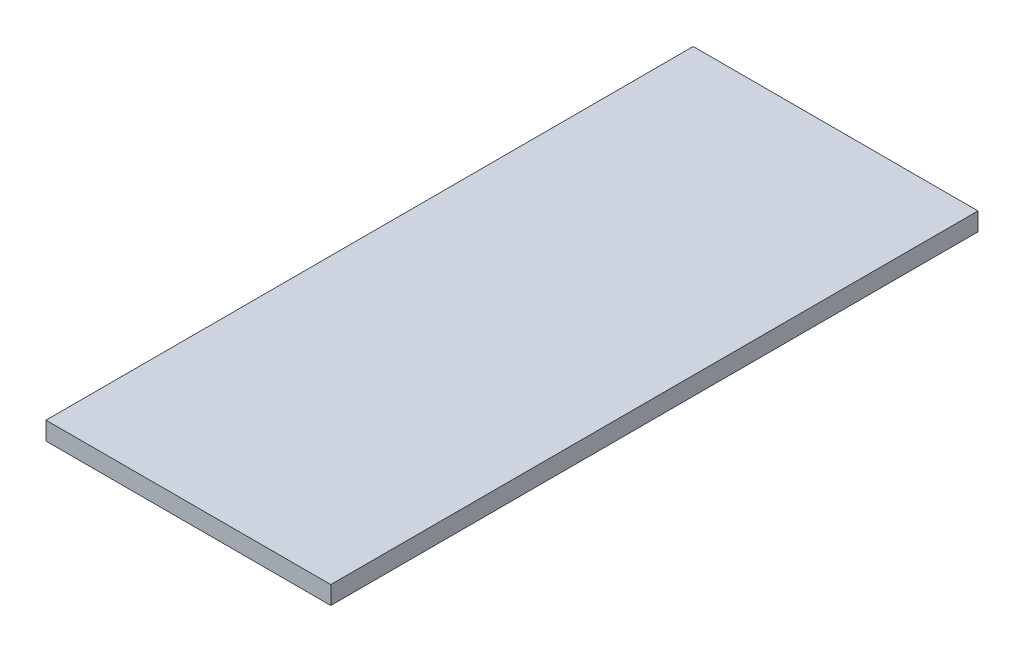
from build123d import *

# Parameters (mm, degrees)
SKETCH1_W           = 110
SKETCH1_H           = 250
BOSS_EXTRUDE1_DEPTH = 7


with BuildPart() as part:
    # Sketch1 → Boss-Extrude1 (new body)
    with BuildSketch(Plane(origin=(0, 0, 0), x_dir=(1, 0, 0), z_dir=(0, 1, 0))):
        Rectangle(SKETCH1_W, SKETCH1_H)
    extrude(amount=BOSS_EXTRUDE1_DEPTH)


solid = part.part
